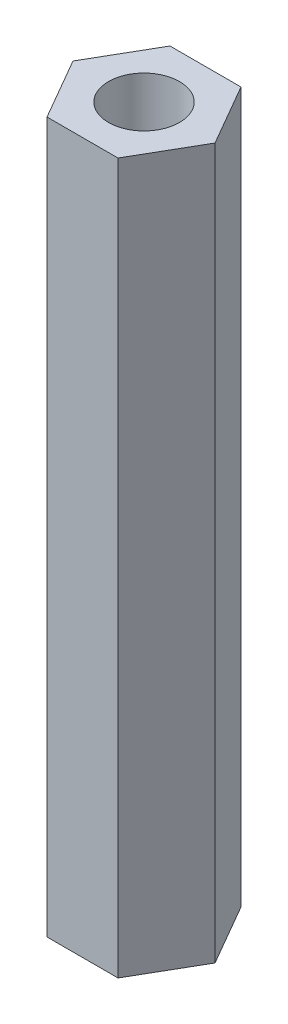
from build123d import *

# Parameters (mm, degrees)
SKETCH1_R           = 0.25
BOSS_EXTRUDE2_DEPTH = 5


with BuildPart() as part:
    # Sketch1 → Boss-Extrude2 (new body)
    with BuildSketch(Plane(origin=(0, 0, 0), x_dir=(1, 0, 0), z_dir=(0, 1, 0))):
        Polygon((-0.250000761, 0.43301402), (-0.500001522, 0), (-0.250000761, -0.43301402), (0.250000761, -0.43301402), (0.500001522, 0), (0.250000761, 0.43301402), align=None)
        with Locations(Location((0, 0, 0), (0, 0, 270))):
            Circle(SKETCH1_R, mode=Mode.SUBTRACT)
    extrude(amount=BOSS_EXTRUDE2_DEPTH)


solid = part.part
